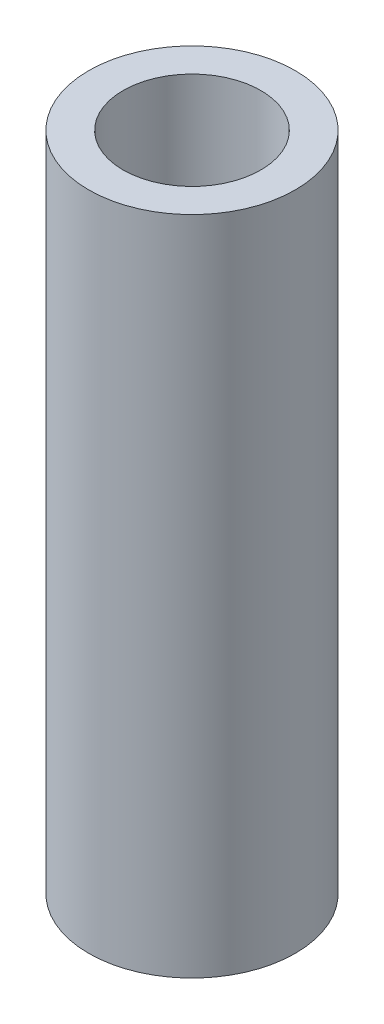
from build123d import *

# Parameters (mm, degrees)
EXTRUDE1_DEPTH          = 30.48
EXTRUDE1_DEPTH_BACK     = 30.48
SKETCH1_R               = 9.525
CUT_EXTRUDE1_DEPTH      = 34.323890079
CUT_EXTRUDE1_DEPTH_BACK = 34.323890079
SKETCH2_R               = 6.35


with BuildPart() as part:
    # Sketch1 → Extrude1 (new, two sides: drawn at the far end of the back side and taken through both)
    with BuildSketch(Plane(origin=(0, 0, 0), x_dir=(1, 0, 0), z_dir=(0, 1, 0)).offset(-EXTRUDE1_DEPTH_BACK)):
        with Locations(Location((0, 0, 0), (0, 0, 270))):
            Circle(SKETCH1_R)
    extrude(amount=EXTRUDE1_DEPTH + EXTRUDE1_DEPTH_BACK)

    # Sketch2 → Cut-Extrude1 (cut, two sides: drawn at the far end of the back side and taken through both)
    with BuildSketch(Plane(origin=(0, 0, 0), x_dir=(1, 0, 0), z_dir=(0, 1, 0)).offset(-CUT_EXTRUDE1_DEPTH_BACK)):
        with Locations(Location((0, 0, 0), (0, 0, 270))):
            Circle(SKETCH2_R)
    extrude(amount=CUT_EXTRUDE1_DEPTH + CUT_EXTRUDE1_DEPTH_BACK, mode=Mode.SUBTRACT)


solid = part.part
